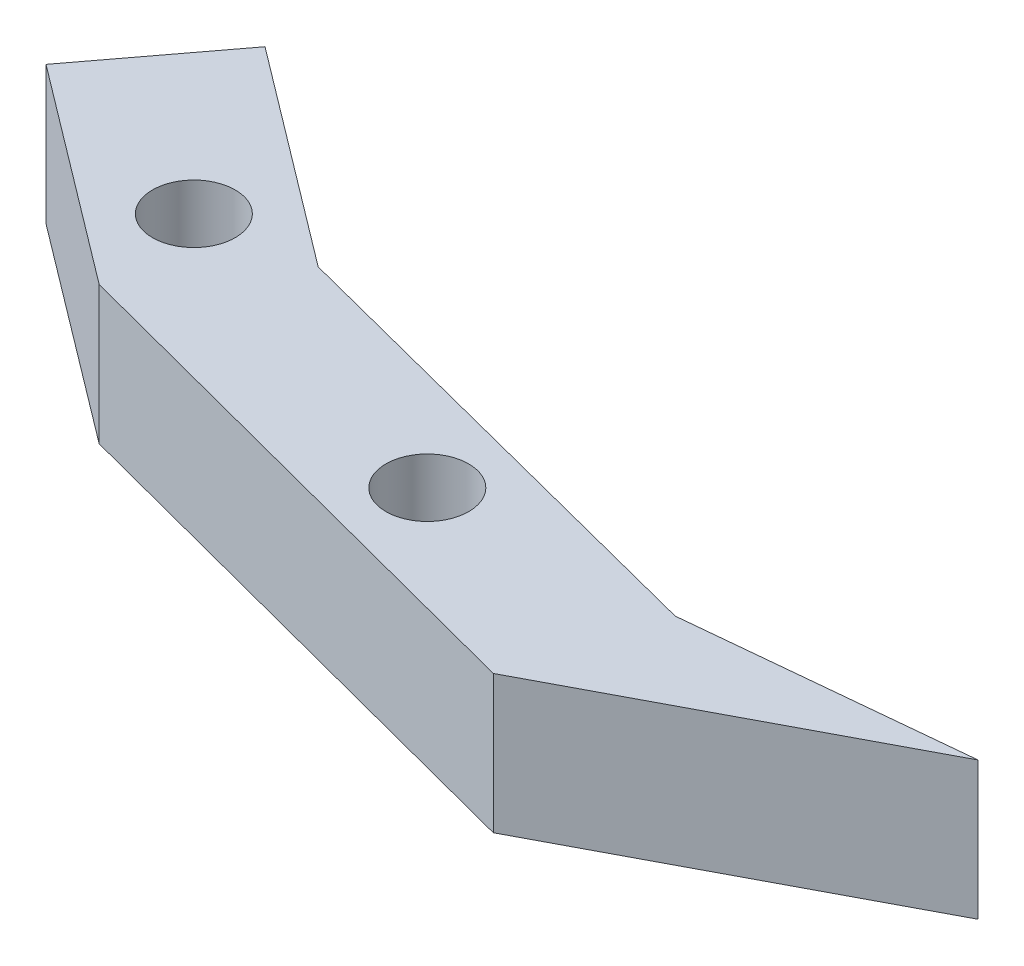
from build123d import *

# Parameters (mm, degrees)
SKETCH_1_R      = 1.5
EXTRUDE_1_DEPTH = 5


with BuildPart() as part:
    # 草图1 → 凸台-拉伸1 (new body)
    with BuildSketch(Plane(origin=(0, 0, 0), x_dir=(1, 0, 0), z_dir=(0, 1, 0))):
        Polygon((-34.456184954, -3.49420181), (-26.584074683, -9.438943538), (-7.236140092, -14.504259625), (4.261211757, -8.437060891), (-5.738788243, -9.408767904), (-23.169375756, -4.917151386), (-31.041486027, 1.027590342), align=None)
        with Locations(Location((-27.087553114, -5.504570551, 0), (0, 0, 270))):
            Circle(SKETCH_1_R, mode=Mode.SUBTRACT)
        with Locations(Location((-14.25994565, -9.87219173, 0), (0, 0, 270))):
            Circle(SKETCH_1_R, mode=Mode.SUBTRACT)
    extrude(amount=EXTRUDE_1_DEPTH)


solid = part.part
